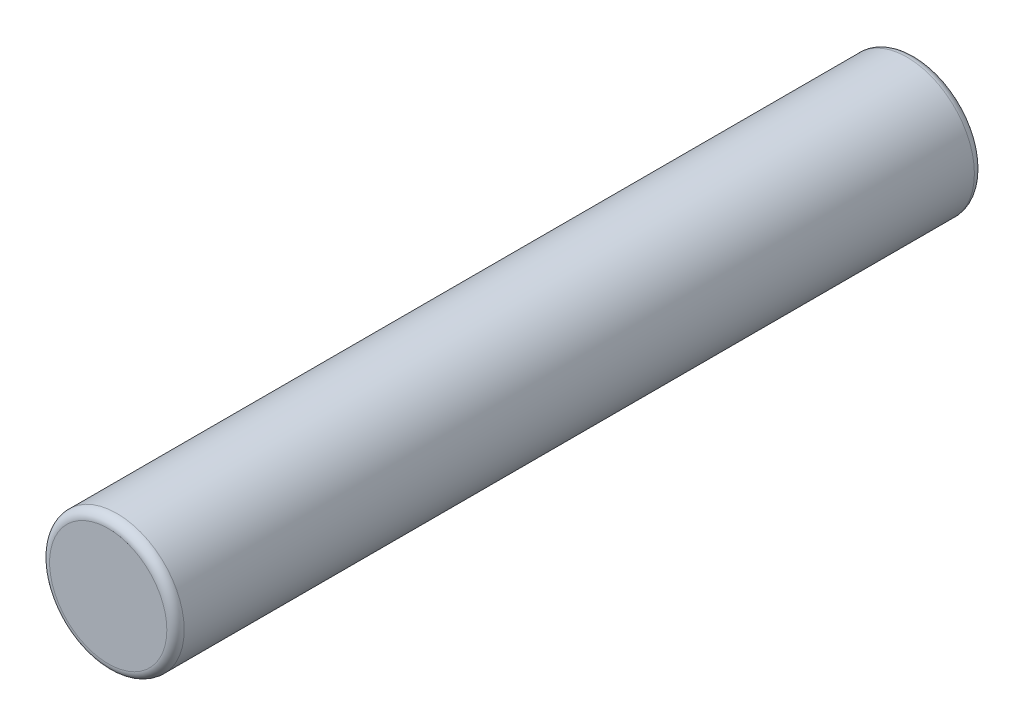
from build123d import *

# Parameters (mm, degrees)
CROQUIS1_R              = 1.5875
SALIENTE_EXTRUIR1_DEPTH = 19.05
REDONDEO1_R             = 0.20483871


with BuildPart() as part:
    # Croquis1 → Saliente-Extruir1 (new body)
    with BuildSketch(Plane.XY):
        with Locations(Location((0, 0, 0), (0, 0, 180))):
            Circle(CROQUIS1_R)
    extrude(amount=SALIENTE_EXTRUIR1_DEPTH)

    # Redondeo1
    redondeo1_edges = [part.edges().sort_by_distance(p)[0] for p in [
        (1.5875, 0, 0),
        (1.5875, 0, 19.05),
    ]]
    fillet(redondeo1_edges, radius=REDONDEO1_R)


solid = part.part
